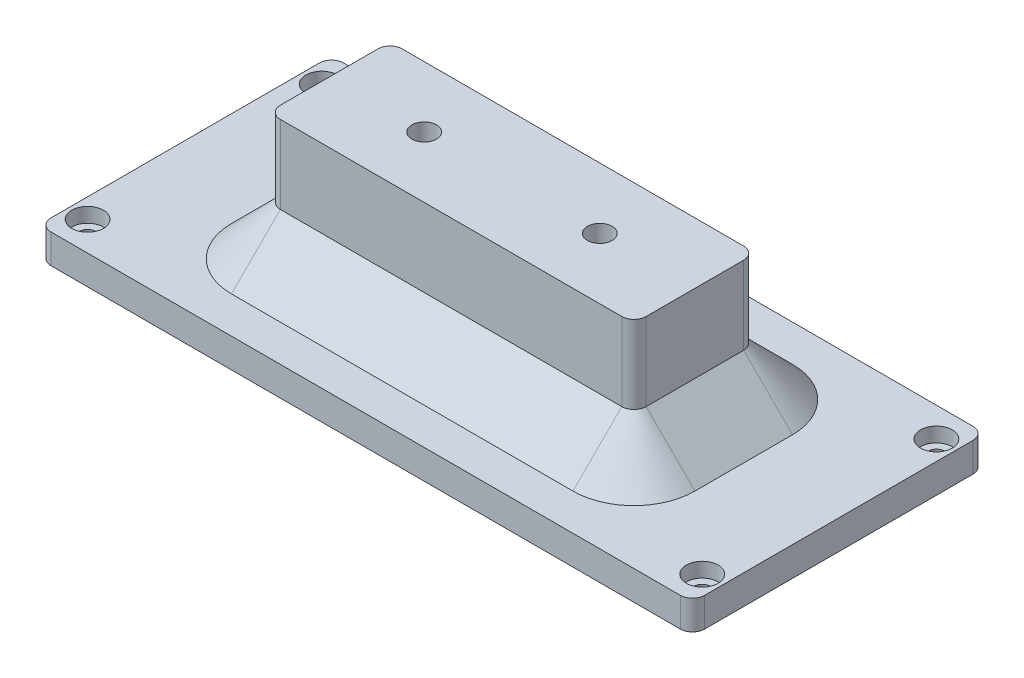
from build123d import *

# Parameters (mm, degrees)
SKETCH1_W                      = 134
SKETCH1_H                      = 60
BOSS_EXTRUDE1_DEPTH            = 6
CBORE_FOR_M3_SHCS1_D           = 3.4
CBORE_FOR_M3_SHCS1_DEPTH       = 17.38
CBORE_FOR_M3_SHCS1_CBORE_D     = 6.5
CBORE_FOR_M3_SHCS1_CBORE_DEPTH = 3
CBORE_FOR_M3_SHCS1_TIP         = 1.021463052
SKETCH4_W                      = 75
SKETCH4_H                      = 25
BOSS_EXTRUDE2_DEPTH            = 26
F_8_0_199_DIAMETER_HOLE1_D     = 5.0546
FILLET1_R                      = 2.5
FILLET2_R                      = 2.5
CHAMFER1_SIZE                  = 10


with BuildPart() as part:
    # Sketch1 → Boss-Extrude1 (new body)
    with BuildSketch(Plane(origin=(0, 0, 0), x_dir=(1, 0, 0), z_dir=(0, 1, 0))):
        Rectangle(SKETCH1_W, SKETCH1_H)
    extrude(amount=BOSS_EXTRUDE1_DEPTH)

    # CBORE for M3 SHCS1
    with Locations(Plane(origin=(0, 6, 0), x_dir=(1, 0, 0), z_dir=(0, 1, 0))):
        with Locations((-63, 24), (-63, -24), (63, -24), (63, 24)):
            CounterBoreHole(CBORE_FOR_M3_SHCS1_D / 2, CBORE_FOR_M3_SHCS1_CBORE_D / 2, CBORE_FOR_M3_SHCS1_CBORE_DEPTH, depth=CBORE_FOR_M3_SHCS1_DEPTH)
            with Locations((0, 0, -(CBORE_FOR_M3_SHCS1_DEPTH + CBORE_FOR_M3_SHCS1_TIP / 2))):  # 118° drill point
                Cone(0, CBORE_FOR_M3_SHCS1_D / 2, CBORE_FOR_M3_SHCS1_TIP, mode=Mode.SUBTRACT)

    # Sketch4 → Boss-Extrude2 (add)
    with BuildSketch(Plane(origin=(0, 6, 0), x_dir=(1, 0, 0), z_dir=(0, 1, 0))):
        Rectangle(SKETCH4_W, SKETCH4_H)
    extrude(amount=BOSS_EXTRUDE2_DEPTH)

    # #8 (0.199) Diameter Hole1 (through all)
    with Locations(Plane(origin=(0, 32, 0), x_dir=(1, 0, 0), z_dir=(0, 1, 0))):
        with Locations((-18, 0), (18, 0)):
            Hole(F_8_0_199_DIAMETER_HOLE1_D / 2)

    # Fillet1
    fillet1_edges = [part.edges().sort_by_distance(p)[0] for p in [
        (67, 3, 30),
        (-67, 3, 30),
        (-67, 3, -30),
        (67, 3, -30),
    ]]
    fillet(fillet1_edges, radius=FILLET1_R)

    # Fillet2
    fillet2_edges = [part.edges().sort_by_distance(p)[0] for p in [
        (37.5, 19, 12.5),
        (37.5, 19, -12.5),
        (-37.5, 19, -12.5),
        (-37.5, 19, 12.5),
    ]]
    fillet(fillet2_edges, radius=FILLET2_R)

    # Chamfer1
    chamfer1_edges = [part.edges().sort_by_distance(p)[0] for p in [
        (37.5, 6, 0),
        (0, 6, 12.5),
        (-37.5, 6, 0),
        (36.767766953, 6, -11.767766953),
        (36.767766953, 6, 11.767766953),
        (-36.767766953, 6, 11.767766953),
        (-36.767766953, 6, -11.767766953),
        (0, 6, -12.5),
    ]]
    chamfer(chamfer1_edges, length=CHAMFER1_SIZE)


solid = part.part
